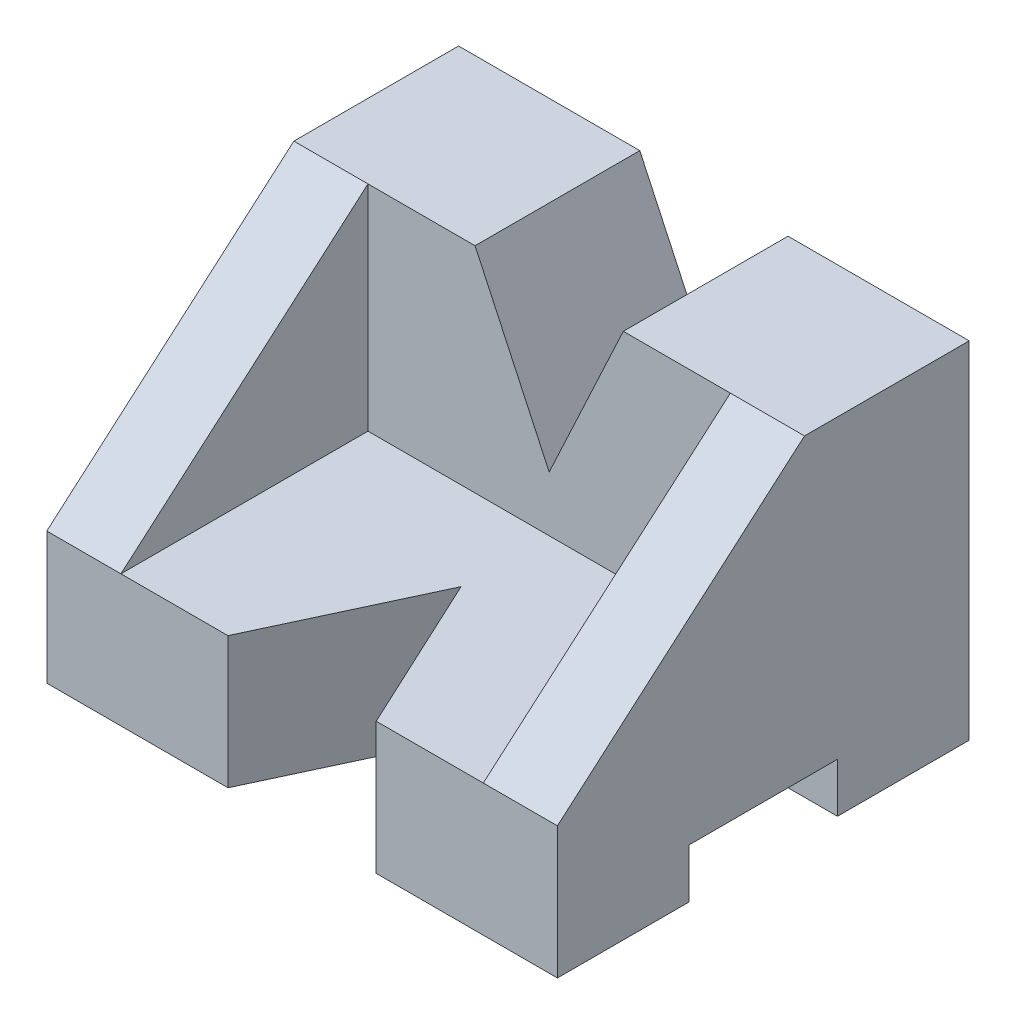
from build123d import *

# Parameters (mm, degrees)
BOSS_EXTRUDE2_DEPTH = 31
BOSS_EXTRUDE3_START = 22
BOSS_EXTRUDE3_DEPTH = 9
BOSS_EXTRUDE4_START = -22
BOSS_EXTRUDE4_DEPTH = 9
CUT_EXTRUDE3_DEPTH  = 46.022216738
CUT_EXTRUDE4_DEPTH  = 46.022216738


with BuildPart() as part:
    # Sketch2 → Boss-Extrude2 (new, symmetric)
    with BuildSketch(Plane(origin=(0, 0, 0), x_dir=(0, 0, -1), z_dir=(1, 0, 0))):
        Polygon((5, 21), (25, 21), (25, -21), (9, -21), (9, -15), (-9, -15), (-9, -21), (-25, -21), (-25, -5), (5, -5), align=None)
    extrude(amount=BOSS_EXTRUDE2_DEPTH, both=True)

    # Sketch3 → Boss-Extrude3 (add)
    with BuildSketch(Plane(origin=(0, 0, 0), x_dir=(0, 0, -1), z_dir=(1, 0, 0)).offset(BOSS_EXTRUDE3_START)):
        Polygon((5, 21), (-25, -5), (5, -5), align=None)
    extrude(amount=BOSS_EXTRUDE3_DEPTH)

    # Sketch3<4> → Boss-Extrude4 (add)
    with BuildSketch(Plane(origin=(0, 0, 0), x_dir=(0, 0, -1), z_dir=(1, 0, 0)).offset(BOSS_EXTRUDE4_START)):
        Polygon((5, 21), (-25, -5), (5, -5), align=None)
    extrude(amount=-BOSS_EXTRUDE4_DEPTH)

    # Sketch4 → Cut-Extrude3 (cut, through all)
    with BuildSketch(Plane(origin=(0, 0, 0), x_dir=(1, 0, 0), z_dir=(0, 1, 0))):
        Polygon((-9, -25), (0, -5.699437715), (9, -25), align=None)
    extrude(amount=-CUT_EXTRUDE3_DEPTH, mode=Mode.SUBTRACT)

    # Sketch6 → Cut-Extrude4 (cut, through all)
    with BuildSketch(Plane.XY):
        Polygon((-9, 21), (0, 1.699437715), (9, 21), align=None)
    extrude(amount=-CUT_EXTRUDE4_DEPTH, mode=Mode.SUBTRACT)


solid = part.part
